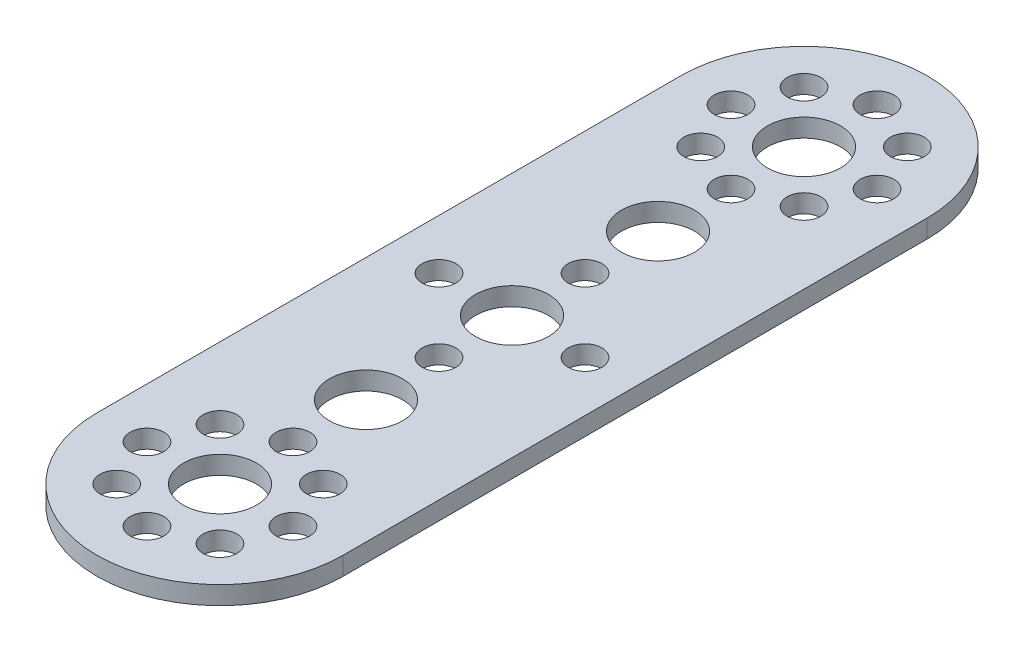
from build123d import *

# Parameters (mm, degrees)
EXTRUDE1_DEPTH = 2
SKETCH3_R      = 4
SKETCH3_R_2    = 1.85
EXTRUDE2_DEPTH = 2


with BuildPart() as part:
    # Sketch2 → Extrude1 (new body)
    with BuildSketch(Plane(origin=(0, 0, 0), x_dir=(1, 0, 0), z_dir=(0, 1, 0))):
        with BuildLine():
            Line((-13.5, -32), (-13.5, 32))
            ThreePointArc((-13.5, 32), (0, 45.5), (13.5, 32))
            Line((13.5, 32), (13.5, -32))
            ThreePointArc((13.5, -32), (0, -45.5), (-13.5, -32))
        make_face()
    extrude(amount=EXTRUDE1_DEPTH)

    # Sketch3 → Extrude2 (cut)
    with BuildSketch(Plane(origin=(0, 2, 0), x_dir=(1, 0, 0), z_dir=(0, 1, 0))):
        with Locations(Location((0, -16, 0), (0, 0, 270))):
            Circle(SKETCH3_R)
        with Locations(Location((0, 16, 0), (0, 0, 270))):
            Circle(SKETCH3_R)
        with Locations(Location((0, 0, 0), (0, 0, 270))):
            Circle(SKETCH3_R)
        with Locations(Location((0, 8, 0), (0, 0, 270))):
            Circle(SKETCH3_R_2)
        with Locations(Location((0, -8, 0), (0, 0, 270))):
            Circle(SKETCH3_R_2)
        with Locations(Location((8, 0, 0), (0, 0, 270))):
            Circle(SKETCH3_R_2)
        with Locations(Location((-8, 0, 0), (0, 0, 270))):
            Circle(SKETCH3_R_2)
        with Locations(Location((0, -24, 0), (0, 0, 270))):
            Circle(SKETCH3_R_2)
        with Locations(Location((8, -32, 0), (0, 0, 270))):
            Circle(SKETCH3_R_2)
        with Locations(Location((0, -32, 0), (0, 0, 270))):
            Circle(SKETCH3_R)
        with Locations(Location((-8, -32, 0), (0, 0, 270))):
            Circle(SKETCH3_R_2)
        with Locations(Location((-5.66, -37.66, 0), (0, 0, 270))):
            Circle(SKETCH3_R_2)
        with Locations(Location((5.66, -37.66, 0), (0, 0, 270))):
            Circle(SKETCH3_R_2)
        with Locations(Location((0, -40, 0), (0, 0, 270))):
            Circle(SKETCH3_R_2)
        with Locations(Location((-5.66, -26.34, 0), (0, 0, 270))):
            Circle(SKETCH3_R_2)
        with Locations(Location((5.66, -26.34, 0), (0, 0, 270))):
            Circle(SKETCH3_R_2)
        with Locations(Location((0, 40, 0), (0, 0, 270))):
            Circle(SKETCH3_R_2)
        with Locations(Location((8, 32, 0), (0, 0, 270))):
            Circle(SKETCH3_R_2)
        with Locations(Location((0, 32, 0), (0, 0, 270))):
            Circle(SKETCH3_R)
        with Locations(Location((-8, 32, 0), (0, 0, 270))):
            Circle(SKETCH3_R_2)
        with Locations(Location((-5.66, 26.34, 0), (0, 0, 270))):
            Circle(SKETCH3_R_2)
        with Locations(Location((5.66, 26.34, 0), (0, 0, 270))):
            Circle(SKETCH3_R_2)
        with Locations(Location((0, 24, 0), (0, 0, 270))):
            Circle(SKETCH3_R_2)
        with Locations(Location((-5.66, 37.66, 0), (0, 0, 270))):
            Circle(SKETCH3_R_2)
        with Locations(Location((5.66, 37.66, 0), (0, 0, 270))):
            Circle(SKETCH3_R_2)
    extrude(amount=-EXTRUDE2_DEPTH, mode=Mode.SUBTRACT)


solid = part.part
